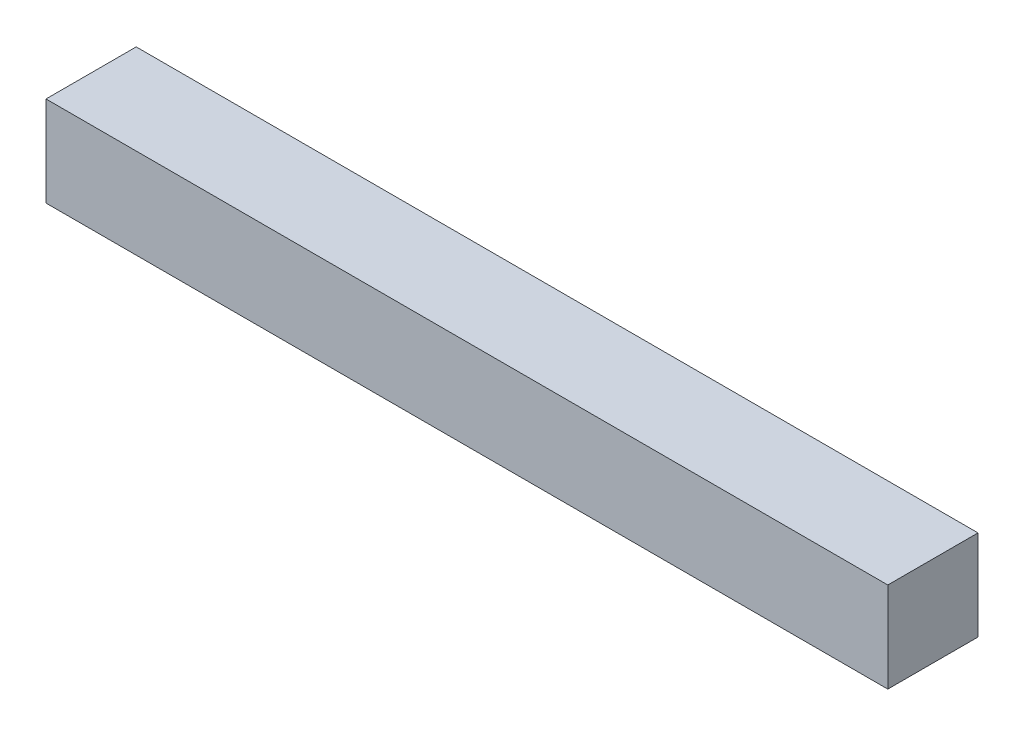
from build123d import *

# Parameters (mm, degrees)
SKETCH1_W           = 38.1
SKETCH1_H           = 38.1
BOSS_EXTRUDE1_DEPTH = 355.6


with BuildPart() as part:
    # Sketch1 → Boss-Extrude1 (new body)
    with BuildSketch(Plane(origin=(0, 0, 0), x_dir=(0, 0, -1), z_dir=(1, 0, 0))):
        Rectangle(SKETCH1_W, SKETCH1_H)
    extrude(amount=BOSS_EXTRUDE1_DEPTH)


solid = part.part
